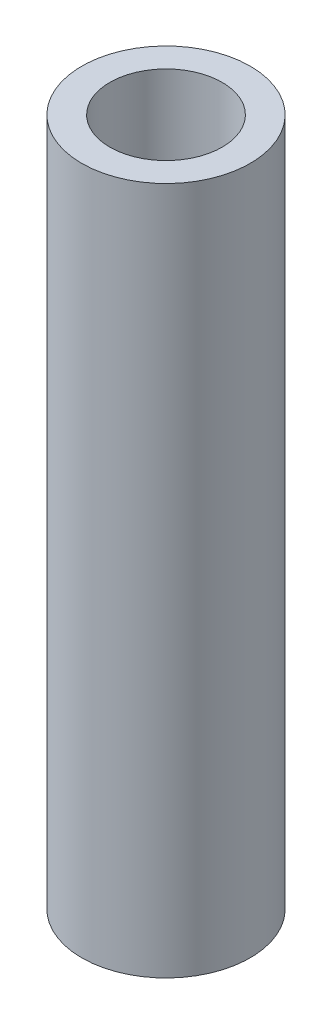
from build123d import *

# Parameters (mm, degrees)
ESQUISSE1_R        = 3
ESQUISSE1_R_2      = 2
BOSS_EXTRU_1_DEPTH = 24.5


with BuildPart() as part:
    # Esquisse1 → Boss.-Extru.1 (new body)
    with BuildSketch(Plane(origin=(0, 0, 0), x_dir=(1, 0, 0), z_dir=(0, 1, 0))):
        with Locations(Location((-29.652119072, -2.638536019, 0), (0, 0, 270))):
            Circle(ESQUISSE1_R)
        with Locations(Location((-29.652119072, -2.638536019, 0), (0, 0, 270))):
            Circle(ESQUISSE1_R_2, mode=Mode.SUBTRACT)
    extrude(amount=BOSS_EXTRU_1_DEPTH)


solid = part.part
